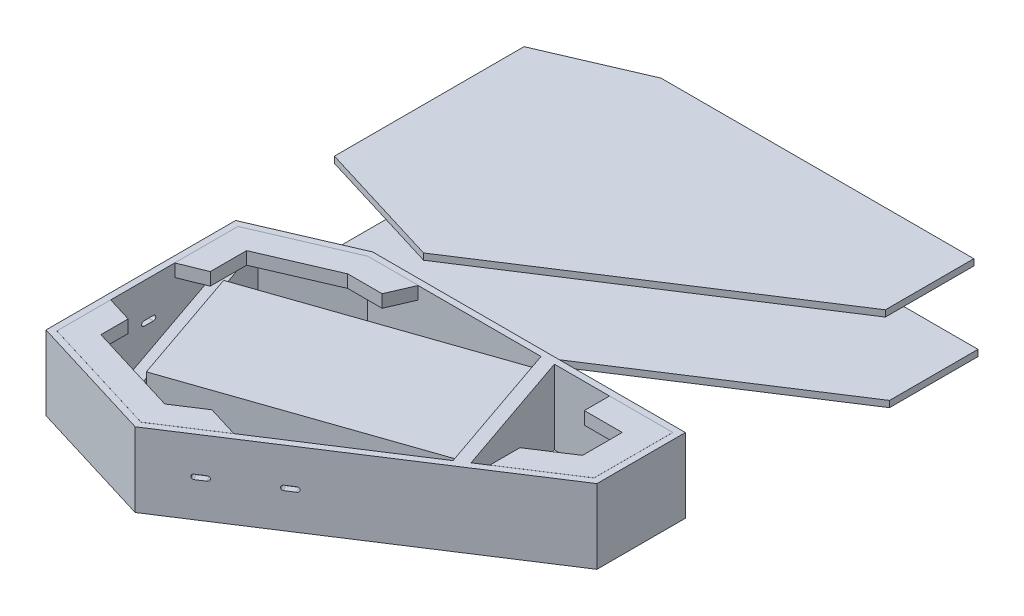
from build123d import *

# Parameters (mm, degrees)
BOSS_EXTRUDE1_DEPTH = 74.6125
BOSS_EXTRUDE2_DEPTH = 70.104
BOSS_EXTRUDE3_DEPTH = 12.7
BOSS_EXTRUDE4_DEPTH = 12.7
BOSS_EXTRUDE5_DEPTH = 12.7
LPATTERN2_COUNT     = 2
LPATTERN2_PITCH     = 61.976
LPATTERN3_COUNT     = 2
LPATTERN3_PITCH     = 61.976
LPATTERN4_COUNT     = 2
LPATTERN4_PITCH     = 61.976
CUT_EXTRUDE1_DEPTH  = 6.604
CUT_EXTRUDE2_DEPTH  = 6.604
BOSS_EXTRUDE6_DEPTH = 74.6125
BOSS_EXTRUDE7_DEPTH = 49.276
BOSS_EXTRUDE8_DEPTH = 6.35
BOSS_EXTRUDE9_DEPTH = 6.35


with BuildPart() as part:
    # Sketch1 → Boss-Extrude1 (new body)
    with BuildSketch(Plane(origin=(0, 0, 0), x_dir=(1, 0, 0), z_dir=(0, 1, 0))):
        Polygon((89.868600995, 45.648080015), (404.193600995, 45.648080015), (404.193600995, -43.251919985), (122.691373008, -225.814419985), (-6.35, -186.362513079), (-6.35, 4.177832277), align=None)
        Polygon((0, 0), (91.178772423, 39.298080015), (397.843600995, 39.298080015), (397.843600995, -39.801610813), (121.718547276, -218.876854657), (0, -181.663760252), align=None, mode=Mode.SUBTRACT)
    extrude(amount=BOSS_EXTRUDE1_DEPTH)

    # Sketch6 → Boss-Extrude3 (add)
    with BuildSketch(Plane(origin=(-0.579421474, 0, -0.117869918), x_dir=(1, 0, 0), z_dir=(0, 1, 0))):
        Polygon((91.814060346, 39.298080015), (0.635287923, 0), (0.635287923, -63.5), (26.035287923, -53.223829107), (26.035287923, -16.711329107), (97.054746056, 13.898080015), (131.646926177, 13.898080015), (142.614060346, 39.298080015), align=None)
    boss_extrude3 = extrude(amount=BOSS_EXTRUDE3_DEPTH)

    # Sketch8 → Boss-Extrude4 (add)
    with BuildSketch(Plane(origin=(0, 0, -81.231233885), x_dir=(1, 0, 0), z_dir=(0, 1, 0))):
        Polygon((0, -262.943760252), (121.718547276, -300.156854657), (178.280689217, -263.474636858), (146.55570838, -253.775336847), (117.827244348, -272.406593346), (25.4, -244.148748947), (25.4, -216.734319561), (0, -208.968760252), align=None)
    boss_extrude4 = extrude(amount=BOSS_EXTRUDE4_DEPTH)

    # Sketch9 → Boss-Extrude5 (add)
    with BuildSketch(Plane(origin=(0, 0, 0), x_dir=(1, 0, 0), z_dir=(0, 1, 0))):
        Polygon((397.843600995, 39.298080015), (334.343600995, 39.298080015), (334.343600995, 13.898080015), (372.443600995, 13.898080015), (372.443600995, -26.000374123), (334.343600995, -50.709348186), (334.343600995, -80.983234251), (397.843600995, -39.801610813), align=None)
    boss_extrude5 = extrude(amount=BOSS_EXTRUDE5_DEPTH)

    # LPattern2: Boss-Extrude3 ×2
    with Locations(*[(0, i * LPATTERN2_PITCH, 0) for i in range(1, LPATTERN2_COUNT)]):
        add(boss_extrude3)

    # LPattern3: Boss-Extrude4 ×2
    with Locations(*[(0, i * LPATTERN3_PITCH, 0) for i in range(1, LPATTERN3_COUNT)]):
        add(boss_extrude4)

    # LPattern4: Boss-Extrude5 ×2
    with Locations(*[(0, i * LPATTERN4_PITCH, 0) for i in range(1, LPATTERN4_COUNT)]):
        add(boss_extrude5)

    # Sketch12 → Cut-Extrude1 (cut)
    with BuildSketch(Plane(origin=(139.41395441, 0, 214.96933258), x_dir=(0.8390069231931274, 0, -0.5441207428815794), z_dir=(0.5441207428815794, 0, 0.8390069231931274))):
        with BuildLine():
            Line((22.931101414, 39.6875), (32.456101414, 39.6875))
            ThreePointArc((32.456101414, 39.6875), (34.837351414, 37.30625), (32.456101414, 34.925))
            Line((32.456101414, 34.925), (22.931101414, 34.925))
            ThreePointArc((22.931101414, 34.925), (20.549851414, 37.30625), (22.931101414, 39.6875))
        make_face()
        with BuildLine():
            Line((88.018601414, 39.6875), (97.543601414, 39.6875))
            ThreePointArc((97.543601414, 39.6875), (99.924851414, 37.30625), (97.543601414, 34.925))
            Line((97.543601414, 34.925), (88.018601414, 34.925))
            ThreePointArc((88.018601414, 34.925), (85.637351414, 37.30625), (88.018601414, 39.6875))
        make_face()
    extrude(amount=-CUT_EXTRUDE1_DEPTH, mode=Mode.SUBTRACT)

    # Sketch14 → Cut-Extrude2 (cut)
    with BuildSketch(Plane.ZY.offset(6.35)):
        with BuildLine():
            Line((149.850013079, 39.65575), (159.375013079, 39.65575))
            ThreePointArc((159.375013079, 39.65575), (161.756263079, 37.2745), (159.375013079, 34.89325))
            Line((159.375013079, 34.89325), (149.850013079, 34.89325))
            ThreePointArc((149.850013079, 34.89325), (147.468763079, 37.2745), (149.850013079, 39.65575))
        make_face()
        with BuildLine():
            Line((84.762513079, 39.65575), (94.287513079, 39.65575))
            ThreePointArc((94.287513079, 39.65575), (96.668763079, 37.2745), (94.287513079, 34.89325))
            Line((94.287513079, 34.89325), (84.762513079, 34.89325))
            ThreePointArc((84.762513079, 34.89325), (82.381263079, 37.2745), (84.762513079, 39.65575))
        make_face()
    extrude(amount=-CUT_EXTRUDE2_DEPTH, mode=Mode.SUBTRACT)

    # Sketch15 → Boss-Extrude6 (add)
    with BuildSketch(Plane(origin=(0, 0, 0), x_dir=(1, 0, 0), z_dir=(0, 1, 0))):
        Polygon((311.870652445, -95.557604404), (265.43611649, 39.298080015), (278.867899141, 39.298080015), (322.850551087, -88.436816195), align=None)
    extrude(amount=BOSS_EXTRUDE6_DEPTH)

    # Sketch17 → Boss-Extrude7 (add)
    with BuildSketch(Plane(origin=(0, 12.7, 0), x_dir=(1, 0, 0), z_dir=(0, 1, 0))):
        Polygon((88.258946348, -208.647228064), (14.294556224, 6.160958295), (2.492263114, 1.074166197), (73.11042215, -204.015859438), align=None)
    extrude(amount=BOSS_EXTRUDE7_DEPTH)


with BuildPart() as body_2:
    # Sketch2 → Boss-Extrude2 (new body)
    with BuildSketch(Plane(origin=(52.712309054, 0, 182.271693664), x_dir=(1, 0, 0), z_dir=(0, 1, 0))):
        Polygon((-17.462985573, 132.812645381), (214.293072493, 212.61265572), (255.06136793, 94.212928646), (23.305309865, 14.412918307), align=None)
    extrude(amount=BOSS_EXTRUDE2_DEPTH)


with BuildPart() as body_3:
    # Sketch18 → Boss-Extrude8 (new body)
    with BuildSketch(Plane(origin=(0, 74.6125, 0), x_dir=(1, 0, 0), z_dir=(0, 1, 0))):
        Polygon((404.193600995, 246.596861523), (122.691373008, 64.034361523), (-6.35, 103.486268429), (-6.35, 294.026613784), (89.868600995, 335.496861523), (404.193600995, 335.496861523), align=None)
    extrude(amount=BOSS_EXTRUDE8_DEPTH)


with BuildPart() as body_4:
    # Sketch19 → Boss-Extrude9 (new body)
    with BuildSketch(Plane.XZ):
        Polygon((122.691373008, -68.217878295), (-6.35, -107.669785201), (-6.35, -298.210130556), (89.868600995, -339.680378295), (404.193600995, -339.680378295), (404.193600995, -250.780378295), align=None)
    extrude(amount=BOSS_EXTRUDE9_DEPTH)


solid = Compound([part.part, body_2.part, body_3.part, body_4.part])
